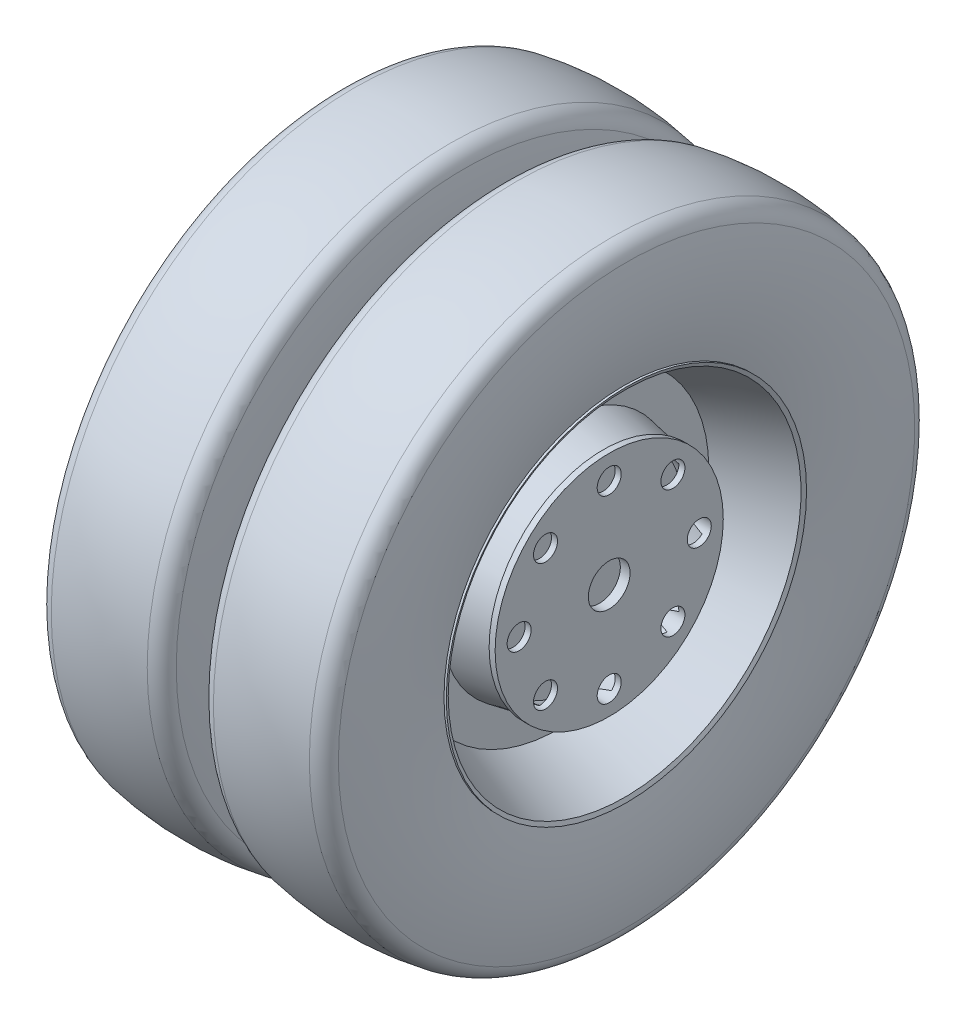
from build123d import *

# Parameters (mm, degrees)
SKETCH2_R          = 20
CUT_EXTRUDE1_DEPTH = 50
SKETCH3_R          = 15
CUT_EXTRUDE2_DEPTH = 830.41641626


with BuildPart() as part:
    # Sketch1 → Revolve1 (revolve)
    with BuildSketch(Plane.XY, mode=Mode.PRIVATE) as revolve1_sk:
        with BuildLine():
            Line((-195, 0), (158.955552551, 0))
            Line((158.955552551, 0), (158.955552551, 34.746883554))
            Line((158.955552551, 34.746883554), (175.165277182, 34.746883554))
            Line((175.165277182, 34.746883554), (175.165277182, 190))
            Line((175.165277182, 190), (165.165277182, 190))
            Line((165.165277182, 190), (165.165277182, 181.346210168))
            Line((165.165277182, 181.346210168), (90.693350449, 194.573850943))
            Line((90.693350449, 194.573850943), (90.693350449, 250.361088181))
            Line((90.693350449, 250.361088181), (200.841809996, 293.75906668))
            Line((200.841809996, 293.75906668), (203.837307262, 300))
            Line((203.837307262, 300), (200, 300))
            ThreePointArc((200, 300), (211.134919564, 389.745181475), (204.100816398, 479.904515014))
            ThreePointArc((204.100816398, 479.904515014), (195.790750782, 495.790750782), (179.904515014, 504.100816398))
            ThreePointArc((179.904515014, 504.100816398), (100, 511.25178063), (20.095484986, 504.100816398))
            ThreePointArc((20.095484986, 504.100816398), (4.209249218, 495.790750782), (-4.100816398, 479.904515014))
            ThreePointArc((-4.100816398, 479.904515014), (-11.134919564, 389.745181475), (0, 300))
            Line((0, 300), (0, 213.61481456))
            Line((0, 213.61481456), (-70, 213.61481456))
            Line((-70, 213.61481456), (-70, 300))
            ThreePointArc((-70, 300), (-58.865080436, 389.745181475), (-65.899183602, 479.904515014))
            ThreePointArc((-65.899183602, 479.904515014), (-74.209249218, 495.790750782), (-90.095484986, 504.100816398))
            ThreePointArc((-90.095484986, 504.100816398), (-170, 511.25178063), (-249.904515014, 504.100816398))
            ThreePointArc((-249.904515014, 504.100816398), (-265.790750782, 495.790750782), (-274.100816398, 479.904515014))
            ThreePointArc((-274.100816398, 479.904515014), (-281.134919564, 389.745181475), (-270, 300))
            Line((-270, 300), (-220, 250))
            Line((-220, 250), (-220, 215))
            Line((-220, 215), (-195, 215))
            Line((-195, 215), (-195, 0))
        make_face()
        Polygon((165.165277182, 152.040173803), (165.165277182, 61.25178063), (125.165277182, 61.25178063), (125.165277182, 172.170344819), (165.165277182, 165.065578578), align=None, mode=Mode.SUBTRACT)
    revolve(revolve1_sk.sketch.rotate(Axis((-195, 0, 0), (1, 0, 0)), 90), axis=Axis((-195, 0, 0), (1, 0, 0)))

    # Sketch2 → Cut-Extrude1 (cut)
    with BuildSketch(Plane(origin=(175.165277182, 0, 0), x_dir=(0, 0, -1), z_dir=(1, 0, 0))):
        with Locations((0, 150)):
            Circle(SKETCH2_R)
        with Locations((106.066017178, 106.066017178)):
            Circle(SKETCH2_R)
        with Locations((150, 0)):
            Circle(SKETCH2_R)
        with Locations((106.066017178, -106.066017178)):
            Circle(SKETCH2_R)
        with Locations((0, -150)):
            Circle(SKETCH2_R)
        with Locations((-106.066017178, -106.066017178)):
            Circle(SKETCH2_R)
        with Locations((-150, 0)):
            Circle(SKETCH2_R)
        with Locations((-106.066017178, 106.066017178)):
            Circle(SKETCH2_R)
    extrude(amount=-CUT_EXTRUDE1_DEPTH, mode=Mode.SUBTRACT)

    # Sketch3 → Cut-Extrude2 (cut, through all)
    with BuildSketch(Plane(origin=(125.165277182, 0, 0), x_dir=(0, 0, -1), z_dir=(1, 0, 0))):
        with Locations((0, 150)):
            Circle(SKETCH3_R)
        with Locations((106.066017178, 106.066017178)):
            Circle(SKETCH3_R)
        with Locations((150, 0)):
            Circle(SKETCH3_R)
        with Locations((106.066017178, -106.066017178)):
            Circle(SKETCH3_R)
        with Locations((0, -150)):
            Circle(SKETCH3_R)
        with Locations((-106.066017178, -106.066017178)):
            Circle(SKETCH3_R)
        with Locations((-150, 0)):
            Circle(SKETCH3_R)
        with Locations((-106.066017178, 106.066017178)):
            Circle(SKETCH3_R)
    extrude(amount=-CUT_EXTRUDE2_DEPTH, mode=Mode.SUBTRACT)


solid = part.part
